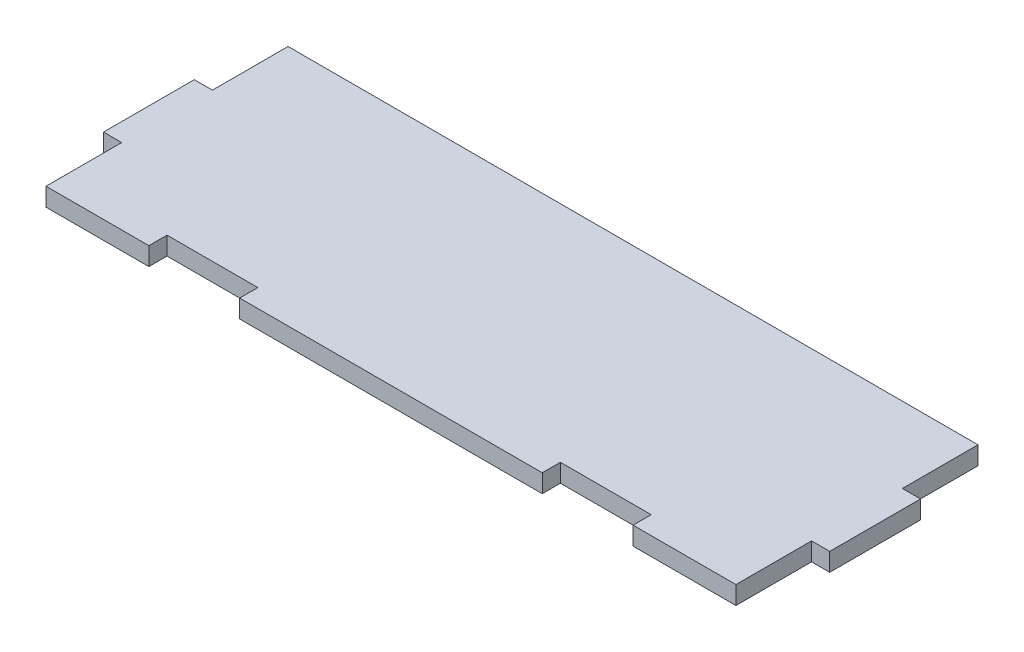
from build123d import *

# Parameters (mm, degrees)
SKETCH1_W           = 120
SKETCH1_H           = 40
BOSS_EXTRUDE1_DEPTH = 3
SKETCH2_W           = 3
SKETCH2_H           = 12.5
CUT_EXTRUDE1_DEPTH  = 64.316664473
SKETCH3_W           = 15
SKETCH3_H           = 3
CUT_EXTRUDE2_DEPTH  = 64.316664473


with BuildPart() as part:
    # Sketch1 → Boss-Extrude1 (new body)
    with BuildSketch(Plane(origin=(0, 0, 0), x_dir=(1, 0, 0), z_dir=(0, 1, 0))):
        Rectangle(SKETCH1_W, SKETCH1_H)
    extrude(amount=BOSS_EXTRUDE1_DEPTH)

    # Sketch2 → Cut-Extrude1 (cut, through all)
    with BuildSketch(Plane(origin=(0, 3, 0), x_dir=(1, 0, 0), z_dir=(0, 1, 0))):
        with Locations((-58.5, 13.75)):
            Rectangle(SKETCH2_W, SKETCH2_H)
        with Locations((-58.5, -13.75)):
            Rectangle(SKETCH2_W, SKETCH2_H)
        with Locations((58.5, 13.75)):
            Rectangle(SKETCH2_W, SKETCH2_H)
        with Locations((58.5, -13.75)):
            Rectangle(SKETCH2_W, SKETCH2_H)
    extrude(amount=-CUT_EXTRUDE1_DEPTH, mode=Mode.SUBTRACT)

    # Sketch3 → Cut-Extrude2 (cut, through all)
    with BuildSketch(Plane(origin=(0, 3, 0), x_dir=(1, 0, 0), z_dir=(0, 1, 0))):
        with Locations((-32.5, -18.5)):
            Rectangle(SKETCH3_W, SKETCH3_H)
        with Locations((32.5, -18.5)):
            Rectangle(SKETCH3_W, SKETCH3_H)
    extrude(amount=-CUT_EXTRUDE2_DEPTH, mode=Mode.SUBTRACT)


solid = part.part
